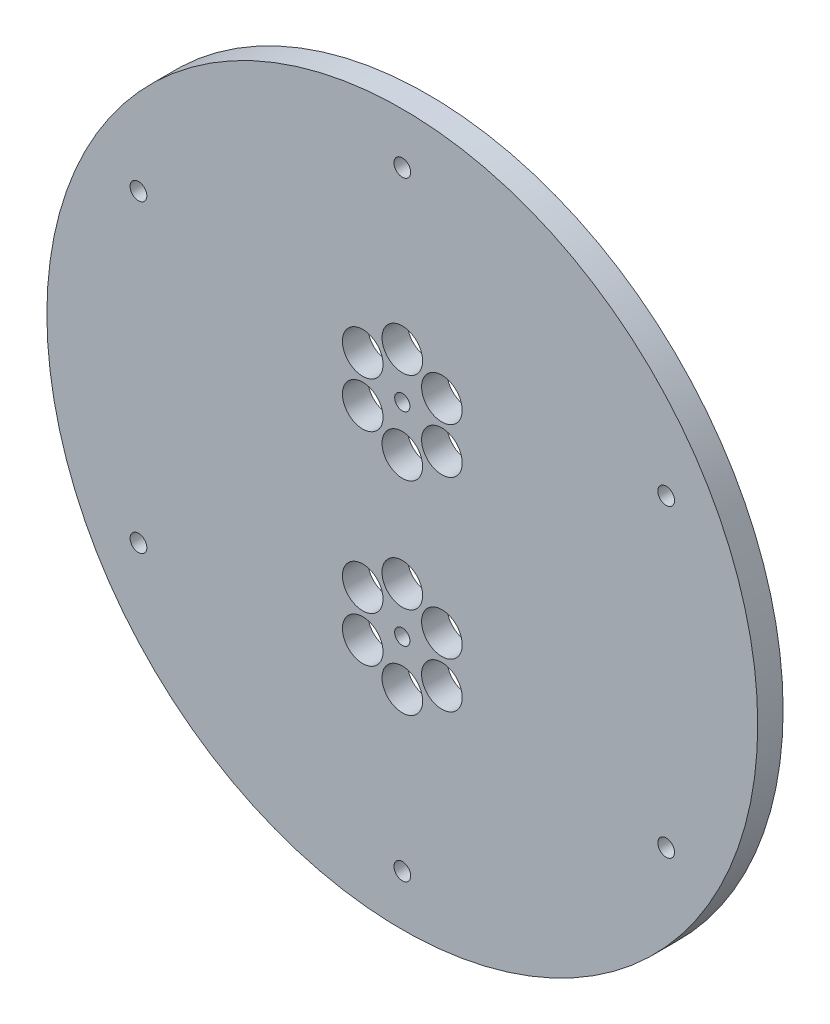
from build123d import *

# Parameters (mm, degrees)
SKETCH1_R           = 70
SKETCH1_R_2         = 1.65
SKETCH1_R_3         = 4
SKETCH1_R_4         = 1.5
BOSS_EXTRUDE1_DEPTH = 5


with BuildPart() as part:
    # Sketch1 → Boss-Extrude1 (new body)
    with BuildSketch(Plane.XY):
        Circle(SKETCH1_R)
        with Locations((0, 60)):
            Circle(SKETCH1_R_2, mode=Mode.SUBTRACT)
        with Locations((51.961524227, 30)):
            Circle(SKETCH1_R_2, mode=Mode.SUBTRACT)
        with Locations((51.961524227, -30)):
            Circle(SKETCH1_R_2, mode=Mode.SUBTRACT)
        with Locations((0, -60)):
            Circle(SKETCH1_R_2, mode=Mode.SUBTRACT)
        with Locations((-51.961524227, -30)):
            Circle(SKETCH1_R_2, mode=Mode.SUBTRACT)
        with Locations((-51.961524227, 30)):
            Circle(SKETCH1_R_2, mode=Mode.SUBTRACT)
        with Locations((0, 29)):
            Circle(SKETCH1_R_3, mode=Mode.SUBTRACT)
        with Locations((7.794228634, 24.5)):
            Circle(SKETCH1_R_3, mode=Mode.SUBTRACT)
        with Locations((7.794228634, 15.5)):
            Circle(SKETCH1_R_3, mode=Mode.SUBTRACT)
        with Locations((0, 11)):
            Circle(SKETCH1_R_3, mode=Mode.SUBTRACT)
        with Locations((-7.794228634, 15.5)):
            Circle(SKETCH1_R_3, mode=Mode.SUBTRACT)
        with Locations((-7.794228634, 24.5)):
            Circle(SKETCH1_R_3, mode=Mode.SUBTRACT)
        with Locations((0, 20)):
            Circle(SKETCH1_R_4, mode=Mode.SUBTRACT)
        with Locations(Location((7.794228634, -15.5, 0), (0, 0, 180))):
            Circle(SKETCH1_R_3, mode=Mode.SUBTRACT)
        with Locations(Location((0, -11, 0), (0, 0, 180))):
            Circle(SKETCH1_R_3, mode=Mode.SUBTRACT)
        with Locations(Location((-7.794228634, -15.5, 0), (0, 0, 180))):
            Circle(SKETCH1_R_3, mode=Mode.SUBTRACT)
        with Locations(Location((0, -20, 0), (0, 0, 180))):
            Circle(SKETCH1_R_4, mode=Mode.SUBTRACT)
        with Locations(Location((-7.794228634, -24.5, 0), (0, 0, 180))):
            Circle(SKETCH1_R_3, mode=Mode.SUBTRACT)
        with Locations(Location((0, -29, 0), (0, 0, 180))):
            Circle(SKETCH1_R_3, mode=Mode.SUBTRACT)
        with Locations(Location((7.794228634, -24.5, 0), (0, 0, 180))):
            Circle(SKETCH1_R_3, mode=Mode.SUBTRACT)
    extrude(amount=BOSS_EXTRUDE1_DEPTH)


solid = part.part
